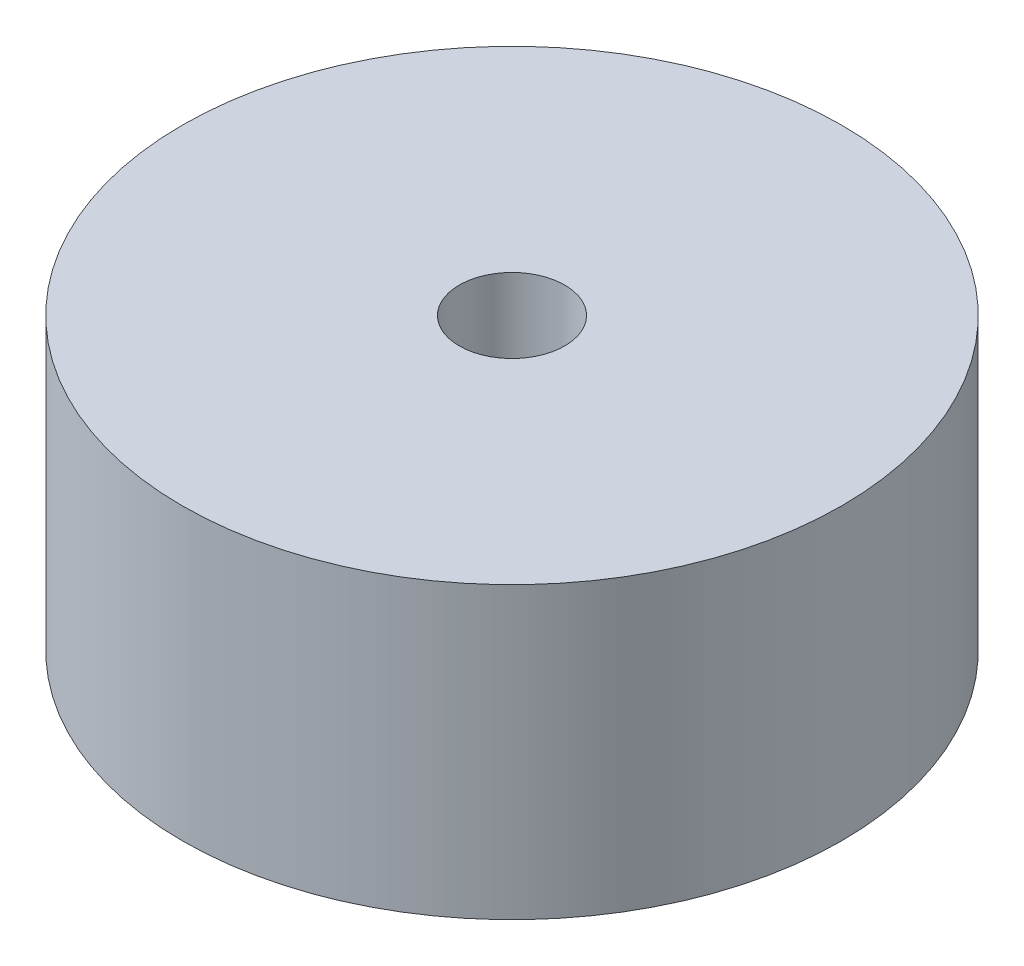
from build123d import *

# Parameters (mm, degrees)
SKETCH1_R               = 12.5
BOSS_EXTRUDE1_DEPTH     = 11
CUT_EXTRUDE1_DEPTH      = 21.820662814
CUT_EXTRUDE1_DEPTH_BACK = 21.820662814
SKETCH2_R               = 2
SKETCH3_R               = 11.5
SKETCH3_R_2             = 5
CUT_EXTRUDE2_DEPTH      = 0.5


with BuildPart() as part:
    # Sketch1 → Boss-Extrude1 (new body)
    with BuildSketch(Plane(origin=(0, 0, 0), x_dir=(1, 0, 0), z_dir=(0, 1, 0))):
        with Locations(Location((0, 0, 0), (0, 0, 270))):
            Circle(SKETCH1_R)
    extrude(amount=BOSS_EXTRUDE1_DEPTH)

    # Sketch2 → Cut-Extrude1 (cut, two sides: drawn at the far end of the back side and taken through both)
    with BuildSketch(Plane(origin=(0, 11, 0), x_dir=(1, 0, 0), z_dir=(0, 1, 0)).offset(-CUT_EXTRUDE1_DEPTH_BACK)):
        with Locations(Location((0, 0, 0), (0, 0, 270))):
            Circle(SKETCH2_R)
    extrude(amount=CUT_EXTRUDE1_DEPTH + CUT_EXTRUDE1_DEPTH_BACK, mode=Mode.SUBTRACT)

    # Sketch3 → Cut-Extrude2 (cut)
    with BuildSketch(Plane.XZ):
        with Locations(Location((0, 0, 0), (0, 0, 270))):
            Circle(SKETCH3_R)
        with Locations(Location((0, 0, 0), (0, 0, 270))):
            Circle(SKETCH3_R_2, mode=Mode.SUBTRACT)
    extrude(amount=-CUT_EXTRUDE2_DEPTH, mode=Mode.SUBTRACT)


solid = part.part
